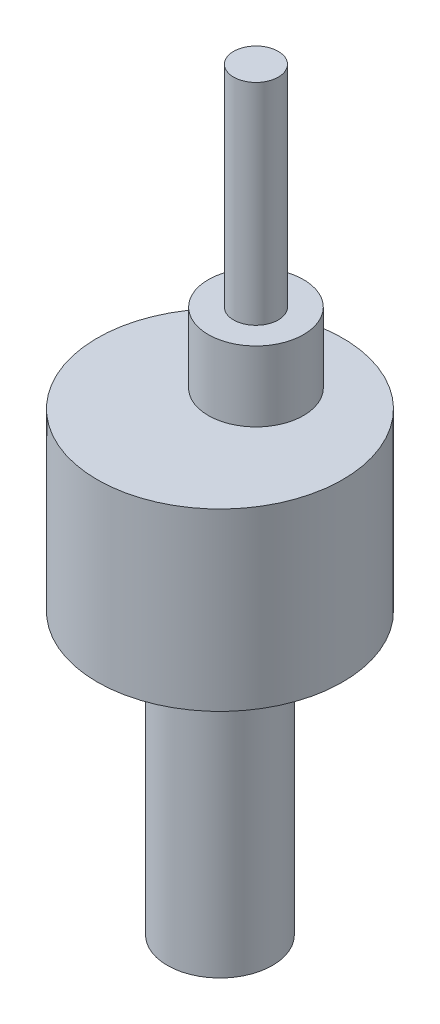
from build123d import *

# Parameters (mm, degrees)
SKETCH1_R           = 22.5
BOSS_EXTRUDE1_DEPTH = 120
SKETCH2_R           = 52.5
BOSS_EXTRUDE2_DEPTH = 75
SKETCH3_R           = 20.382165605
BOSS_EXTRUDE3_DEPTH = 30
SKETCH4_R           = 9.554140127
BOSS_EXTRUDE4_DEPTH = 90


with BuildPart() as part:
    # Sketch1 → Boss-Extrude1 (new body)
    with BuildSketch(Plane(origin=(0, 0, 0), x_dir=(1, 0, 0), z_dir=(0, 1, 0))):
        with Locations(Location((0, 0, 0), (0, 0, 270))):
            Circle(SKETCH1_R)
    extrude(amount=BOSS_EXTRUDE1_DEPTH)

    # Sketch2 → Boss-Extrude2 (add)
    with BuildSketch(Plane(origin=(0, 120, 0), x_dir=(1, 0, 0), z_dir=(0, 1, 0))):
        with Locations(Location((0, 0, 0), (0, 0, 270))):
            Circle(SKETCH2_R)
    extrude(amount=BOSS_EXTRUDE2_DEPTH)

    # Sketch3 → Boss-Extrude3 (add)
    with BuildSketch(Plane(origin=(0, 195, 0), x_dir=(1, 0, 0), z_dir=(0, 1, 0))):
        with Locations(Location((0, 15.406835215, 0), (0, 0, 270))):
            Circle(SKETCH3_R)
    extrude(amount=BOSS_EXTRUDE3_DEPTH)

    # Sketch4 → Boss-Extrude4 (add)
    with BuildSketch(Plane(origin=(0, 225, 0), x_dir=(1, 0, 0), z_dir=(0, 1, 0))):
        with Locations(Location((0, 15.406835215, 0), (0, 0, 90))):
            Circle(SKETCH4_R)
    extrude(amount=BOSS_EXTRUDE4_DEPTH)


solid = part.part
